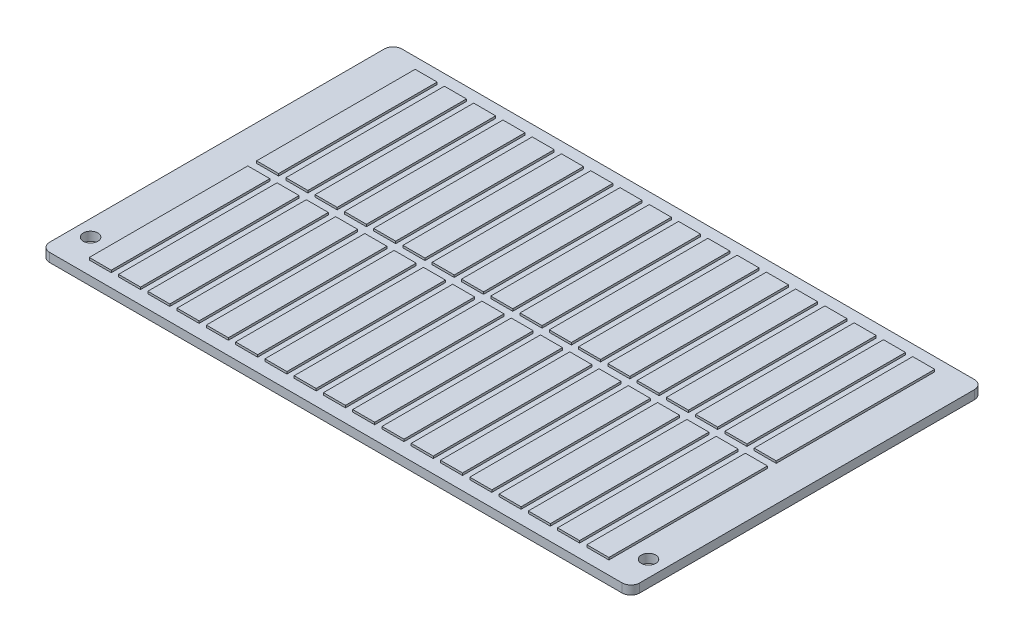
from build123d import *

# Parameters (mm, degrees)
CROQUIS1_W              = 340.36
CROQUIS1_H              = 203.2
SALIENTE_EXTRUIR1_DEPTH = 5.08
CROQUIS2_W              = 12.7
CROQUIS2_H              = 91.44
SALIENTE_EXTRUIR2_DEPTH = 1.27
CROQUIS3_R              = 4.191
CORTAR_EXTRUIR1_DEPTH   = 10
REDONDEO1_R             = 5.08


with BuildPart() as part:
    # Croquis1 → Saliente-Extruir1 (new body)
    with BuildSketch(Plane(origin=(0, 0, 0), x_dir=(1, 0, 0), z_dir=(0, 1, 0))):
        Rectangle(CROQUIS1_W, CROQUIS1_H)
    extrude(amount=SALIENTE_EXTRUIR1_DEPTH)

    # Croquis2 → Saliente-Extruir2 (add)
    with BuildSketch(Plane(origin=(0, 5.08, 0), x_dir=(1, 0, 0), z_dir=(0, 1, 0))):
        with Locations((-143.51, 48.26)):
            Rectangle(CROQUIS2_W, CROQUIS2_H)
        with Locations((-126.626470588, 48.26)):
            Rectangle(CROQUIS2_W, CROQUIS2_H)
        with Locations((-109.742941176, 48.26)):
            Rectangle(CROQUIS2_W, CROQUIS2_H)
        with Locations((-92.859411765, 48.26)):
            Rectangle(CROQUIS2_W, CROQUIS2_H)
        with Locations((-75.975882353, 48.26)):
            Rectangle(CROQUIS2_W, CROQUIS2_H)
        with Locations((-59.092352941, 48.26)):
            Rectangle(CROQUIS2_W, CROQUIS2_H)
        with Locations((-42.208823529, 48.26)):
            Rectangle(CROQUIS2_W, CROQUIS2_H)
        with Locations((-25.325294118, 48.26)):
            Rectangle(CROQUIS2_W, CROQUIS2_H)
        with Locations((-8.441764706, 48.26)):
            Rectangle(CROQUIS2_W, CROQUIS2_H)
        with Locations((8.441764706, 48.26)):
            Rectangle(CROQUIS2_W, CROQUIS2_H)
        with Locations((25.325294118, 48.26)):
            Rectangle(CROQUIS2_W, CROQUIS2_H)
        with Locations((42.208823529, 48.26)):
            Rectangle(CROQUIS2_W, CROQUIS2_H)
        with Locations((59.092352941, 48.26)):
            Rectangle(CROQUIS2_W, CROQUIS2_H)
        with Locations((75.975882353, 48.26)):
            Rectangle(CROQUIS2_W, CROQUIS2_H)
        with Locations((92.859411765, 48.26)):
            Rectangle(CROQUIS2_W, CROQUIS2_H)
        with Locations((109.742941176, 48.26)):
            Rectangle(CROQUIS2_W, CROQUIS2_H)
        with Locations((126.626470588, 48.26)):
            Rectangle(CROQUIS2_W, CROQUIS2_H)
        with Locations((143.51, 48.26)):
            Rectangle(CROQUIS2_W, CROQUIS2_H)
        with Locations((143.51, -48.26)):
            Rectangle(CROQUIS2_W, CROQUIS2_H)
        with Locations((126.626470588, -48.26)):
            Rectangle(CROQUIS2_W, CROQUIS2_H)
        with Locations((109.742941176, -48.26)):
            Rectangle(CROQUIS2_W, CROQUIS2_H)
        with Locations((92.859411765, -48.26)):
            Rectangle(CROQUIS2_W, CROQUIS2_H)
        with Locations((75.975882353, -48.26)):
            Rectangle(CROQUIS2_W, CROQUIS2_H)
        with Locations((59.092352941, -48.26)):
            Rectangle(CROQUIS2_W, CROQUIS2_H)
        with Locations((42.208823529, -48.26)):
            Rectangle(CROQUIS2_W, CROQUIS2_H)
        with Locations((25.325294118, -48.26)):
            Rectangle(CROQUIS2_W, CROQUIS2_H)
        with Locations((8.441764706, -48.26)):
            Rectangle(CROQUIS2_W, CROQUIS2_H)
        with Locations((-8.441764706, -48.26)):
            Rectangle(CROQUIS2_W, CROQUIS2_H)
        with Locations((-25.325294118, -48.26)):
            Rectangle(CROQUIS2_W, CROQUIS2_H)
        with Locations((-42.208823529, -48.26)):
            Rectangle(CROQUIS2_W, CROQUIS2_H)
        with Locations((-59.092352941, -48.26)):
            Rectangle(CROQUIS2_W, CROQUIS2_H)
        with Locations((-75.975882353, -48.26)):
            Rectangle(CROQUIS2_W, CROQUIS2_H)
        with Locations((-92.859411765, -48.26)):
            Rectangle(CROQUIS2_W, CROQUIS2_H)
        with Locations((-109.742941176, -48.26)):
            Rectangle(CROQUIS2_W, CROQUIS2_H)
        with Locations((-126.626470588, -48.26)):
            Rectangle(CROQUIS2_W, CROQUIS2_H)
        with Locations((-143.51, -48.26)):
            Rectangle(CROQUIS2_W, CROQUIS2_H)
    extrude(amount=SALIENTE_EXTRUIR2_DEPTH)

    # Croquis3 → Cortar-Extruir1 (cut)
    with BuildSketch(Plane(origin=(0, 5.08, 0), x_dir=(1, 0, 0), z_dir=(0, 1, 0))):
        with Locations(Location((-160.909, -82.169, 0), (0, 0, 270))):
            Circle(CROQUIS3_R)
        with Locations(Location((160.909, -82.169, 0), (0, 0, 270))):
            Circle(CROQUIS3_R)
    extrude(amount=-CORTAR_EXTRUIR1_DEPTH, mode=Mode.SUBTRACT)

    # Redondeo1
    redondeo1_edges = [part.edges().sort_by_distance(p)[0] for p in [
        (-170.18, 2.54, -101.6),
        (170.18, 2.54, -101.6),
        (170.18, 2.54, 101.6),
        (-170.18, 2.54, 101.6),
    ]]
    fillet(redondeo1_edges, radius=REDONDEO1_R)


solid = part.part
